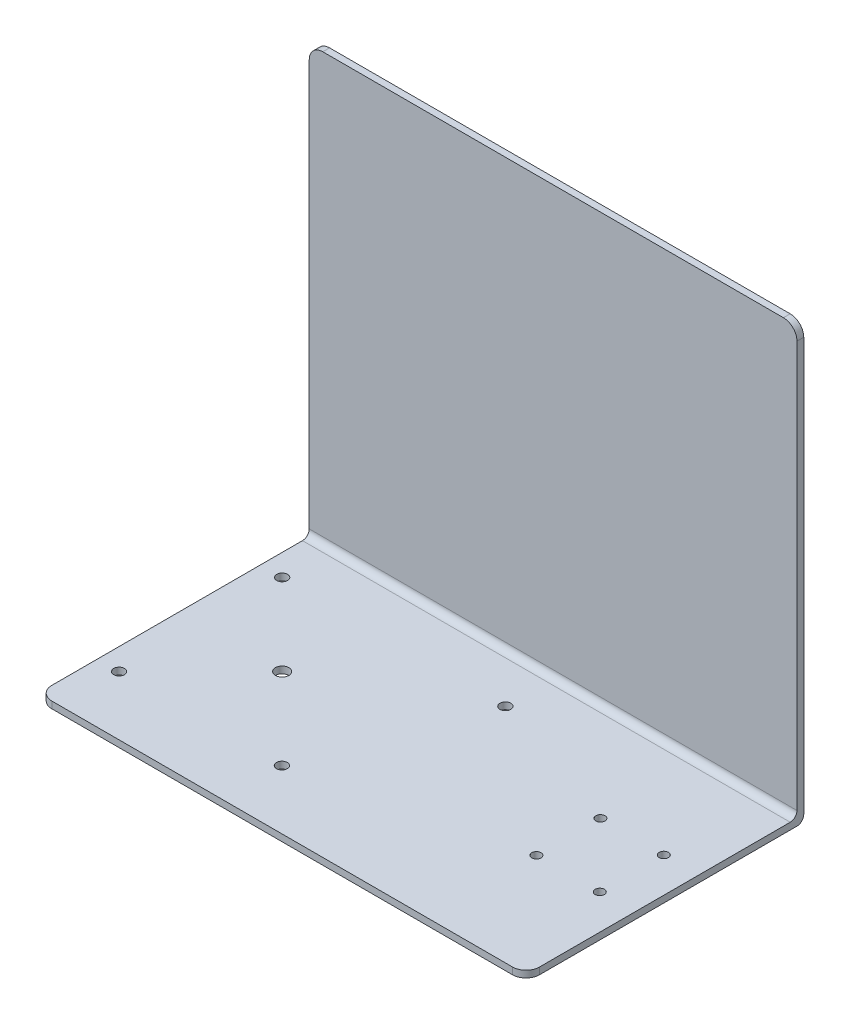
from build123d import *

# Parameters (mm, degrees)
SKETCH2_W           = 228.6
SKETCH2_H           = 203.2
BOSS_EXTRUDE1_DEPTH = 3.175
SKETCH3_W           = 228.6
SKETCH3_H           = 3.175
BOSS_EXTRUDE2_DEPTH = 127
FILLET1_R           = 3.175
FILLET2_R           = 6.35
SKETCH4_R           = 2.54
SKETCH4_R_2         = 2.15
SKETCH4_R_3         = 3.175
CUT_EXTRUDE1_DEPTH  = 265.612965007


with BuildPart() as part:
    # Sketch2 → Boss-Extrude1 (new body)
    with BuildSketch(Plane.XY):
        Rectangle(SKETCH2_W, SKETCH2_H)
    extrude(amount=BOSS_EXTRUDE1_DEPTH)

    # Sketch3 → Boss-Extrude2 (add)
    with BuildSketch(Plane.XY.offset(3.175)):
        with Locations((0, -100.0125)):
            Rectangle(SKETCH3_W, SKETCH3_H)
    extrude(amount=BOSS_EXTRUDE2_DEPTH)

    # Fillet1
    fillet1_edges = [part.edges().sort_by_distance(p)[0] for p in [
        (0, -98.425, 3.175),
        (0, -101.6, 0),
    ]]
    fillet(fillet1_edges, radius=FILLET1_R)

    # Fillet2
    fillet2_edges = [part.edges().sort_by_distance(p)[0] for p in [
        (-114.3, -100.0125, 130.175),
        (114.3, -100.0125, 130.175),
        (-114.3, 101.6, 1.5875),
        (114.3, 101.6, 1.5875),
    ]]
    fillet(fillet2_edges, radius=FILLET2_R)

    # Sketch4 → Cut-Extrude1 (cut, through all)
    with BuildSketch(Plane(origin=(0, -98.425, 0), x_dir=(1, 0, 0), z_dir=(0, 1, 0))):
        with Locations(Location((-104.14, -26.035, 0), (0, 0, 270))):
            Circle(SKETCH4_R)
        with Locations(Location((-104.14, -102.4636, 0), (0, 0, 270))):
            Circle(SKETCH4_R)
        with Locations(Location((0.4826, -26.035, 0), (0, 0, 270))):
            Circle(SKETCH4_R)
        with Locations(Location((-27.8257, -102.4636, 0), (0, 0, 270))):
            Circle(SKETCH4_R)
        with Locations(Location((68.25, -79.2493, 0), (0, 0, 270))):
            Circle(SKETCH4_R_2)
        with Locations(Location((97.95, -79.2493, 0), (0, 0, 270))):
            Circle(SKETCH4_R_2)
        with Locations(Location((68.25, -49.2493, 0), (0, 0, 270))):
            Circle(SKETCH4_R_2)
        with Locations(Location((97.95, -49.2493, 0), (0, 0, 270))):
            Circle(SKETCH4_R_2)
        with Locations(Location((-65.9257, -64.2493, 0), (0, 0, 270))):
            Circle(SKETCH4_R_3)
    extrude(amount=-CUT_EXTRUDE1_DEPTH, mode=Mode.SUBTRACT)


solid = part.part
